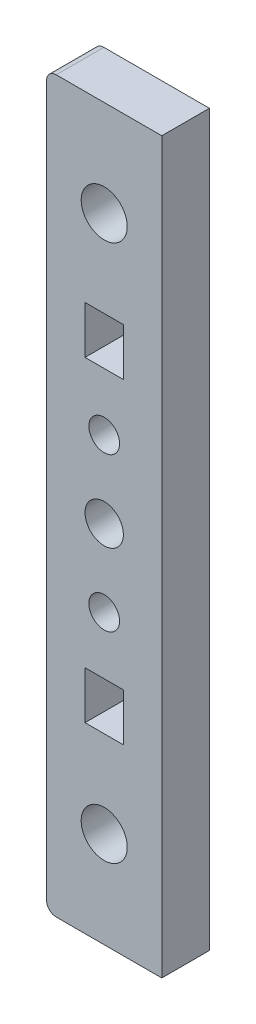
from build123d import *

# Parameters (mm, degrees)
MODEL_R             = 6
MODEL_R_2           = 5
MODEL_R_3           = 4
MODEL_W             = 10
MODEL_H             = 12.4
BOSS_EXTRUDE1_DEPTH = 12.4


with BuildPart() as part:
    # Model → Boss-Extrude1 (new body)
    with BuildSketch(Plane.XY):
        with BuildLine():
            Line((-27.5, 0), (0, 0))
            Line((0, 0), (0, 190))
            Line((0, 190), (-27.5, 190))
            ThreePointArc((-27.5, 190), (-29.267766953, 189.267766953), (-30, 187.5))
            Line((-30, 187.5), (-30, 2.5))
            ThreePointArc((-30, 2.5), (-29.267766953, 0.732233047), (-27.5, 0))
        make_face()
        with Locations(Location((-15, 165, 0), (0, 0, 180))):
            Circle(MODEL_R, mode=Mode.SUBTRACT)
        with Locations(Location((-15, 95, 0), (0, 0, 180))):
            Circle(MODEL_R_2, mode=Mode.SUBTRACT)
        with Locations(Location((-15, 115, 0), (0, 0, 180))):
            Circle(MODEL_R_3, mode=Mode.SUBTRACT)
        with Locations(Location((-15, 25, 0), (0, 0, 180))):
            Circle(MODEL_R, mode=Mode.SUBTRACT)
        with Locations(Location((-15, 75, 0), (0, 0, 180))):
            Circle(MODEL_R_3, mode=Mode.SUBTRACT)
        with Locations((-15, 136.2)):
            Rectangle(MODEL_W, MODEL_H, mode=Mode.SUBTRACT)
        with Locations((-15, 53.8)):
            Rectangle(MODEL_W, MODEL_H, mode=Mode.SUBTRACT)
    extrude(amount=BOSS_EXTRUDE1_DEPTH)


solid = part.part
